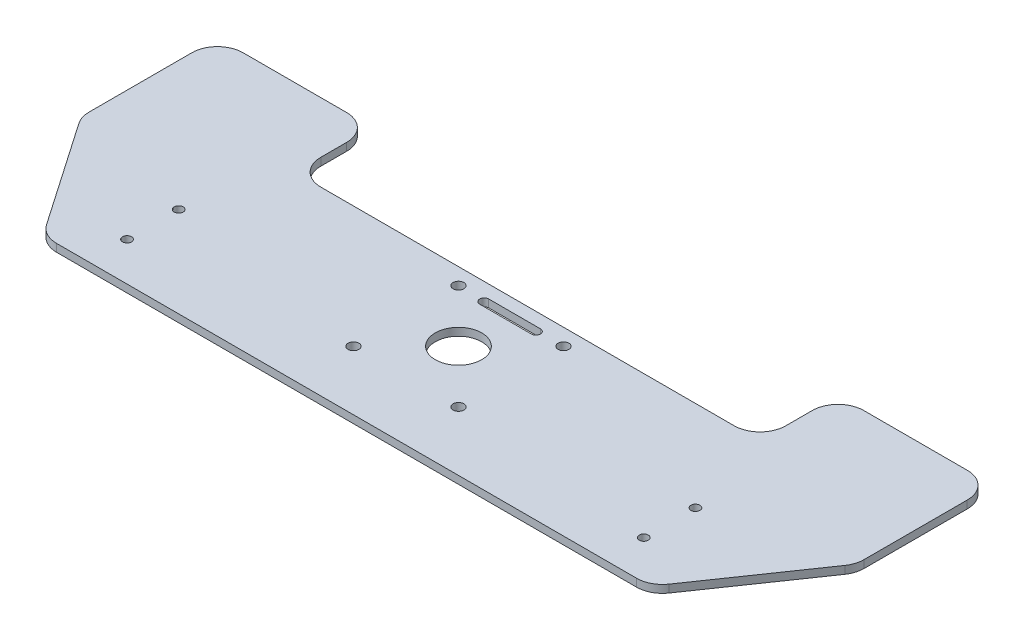
from build123d import *

# Parameters (mm, degrees)
EXTRUDE_1_DEPTH     = 3
SKETCH_2_R          = 1.75
CUT_EXTRUDE_1_DEPTH = 10
CUT_EXTRUDE_2_DEPTH = 3
SKETCH_4_R          = 9
CUT_EXTRUDE_3_DEPTH = 10
SKETCH_5_R          = 2.1
CUT_EXTRUDE_4_DEPTH = 4


with BuildPart() as part:
    # 草图1 → 凸台-拉伸1 (new body)
    with BuildSketch(Plane(origin=(0, 0, 0), x_dir=(1, 0, 0), z_dir=(0, 1, 0))):
        with BuildLine():
            Line((-148.235829522, 19.513411872), (-120.492131082, -20.771152042))
            ThreePointArc((-120.492131082, -20.771152042), (-116.908205257, -23.951300285), (-112.25630156, -25.099193643))
            Line((-112.25630156, -25.099193643), (112.25630156, -25.099193643))
            ThreePointArc((112.25630156, -25.099193643), (116.908205257, -23.951300285), (120.492131082, -20.771152042))
            Line((120.492131082, -20.771152042), (148.235829522, 19.513411872))
            ThreePointArc((148.235829522, 19.513411872), (149.548777283, 22.215378286), (150, 25.185370271))
            Line((150, 25.185370271), (150, 65))
            ThreePointArc((150, 65), (147.169490918, 72.124628896), (140.101052961, 75.092675968))
            Line((140.101052961, 75.092675968), (100.001859318, 75.092675968))
            ThreePointArc((100.001859318, 75.092675968), (92.860872953, 72.096900105), (90, 64.900806357))
            Line((90, 64.900806357), (90, 54.900806357))
            ThreePointArc((90, 54.900806357), (87.071067812, 47.829738545), (80, 44.900806357))
            Line((80, 44.900806357), (-80, 44.900806357))
            ThreePointArc((-80, 44.900806357), (-87.071067812, 47.829738545), (-90, 54.900806357))
            Line((-90, 54.900806357), (-90, 64.900806357))
            ThreePointArc((-90, 64.900806357), (-92.928932188, 71.971874169), (-100, 74.900806357))
            Line((-100, 74.900806357), (-140.099193643, 74.900806357))
            ThreePointArc((-140.099193643, 74.900806357), (-147.100120957, 72.000927314), (-150, 65))
            Line((-150, 65), (-150, 25.185370271))
            ThreePointArc((-150, 25.185370271), (-149.548777283, 22.215378286), (-148.235829522, 19.513411872))
        make_face()
    extrude(amount=EXTRUDE_1_DEPTH)

    # 草图2 → 切除-拉伸1 (cut)
    with BuildSketch(Plane(origin=(0, 3, 0), x_dir=(1, 0, 0), z_dir=(0, 1, 0))):
        with Locations(Location((100, 9.900806357, 0), (0, 0, 270))):
            Circle(SKETCH_2_R)
        with Locations(Location((100, -10.099193643, 0), (0, 0, 270))):
            Circle(SKETCH_2_R)
        with Locations(Location((-100, -10.099193643, 0), (0, 0, 90))):
            Circle(SKETCH_2_R)
        with Locations(Location((-100, 9.900806357, 0), (0, 0, 90))):
            Circle(SKETCH_2_R)
    extrude(amount=-CUT_EXTRUDE_1_DEPTH, mode=Mode.SUBTRACT)

    # 草图3 → 切除-拉伸2 (cut)
    with BuildSketch(Plane(origin=(0, 3, 0), x_dir=(1, 0, 0), z_dir=(0, 1, 0))):
        with BuildLine():
            Line((-10, 39.900806357), (10, 39.900806357))
            ThreePointArc((10, 39.900806357), (11.75, 38.150806357), (10, 36.400806357))
            Line((10, 36.400806357), (-10, 36.400806357))
            ThreePointArc((-10, 36.400806357), (-11.75, 38.150806357), (-10, 39.900806357))
        make_face()
    extrude(amount=-CUT_EXTRUDE_2_DEPTH, mode=Mode.SUBTRACT)

    # 草图4 → 切除-拉伸3 (cut)
    with BuildSketch(Plane(origin=(0, 3, 0), x_dir=(1, 0, 0), z_dir=(0, 1, 0))):
        with Locations(Location((0, 18.185077605, 0), (0, 0, 270))):
            Circle(SKETCH_4_R)
    extrude(amount=-CUT_EXTRUDE_3_DEPTH, mode=Mode.SUBTRACT)

    # 草图5 → 切除-拉伸4 (cut)
    with BuildSketch(Plane.XZ):
        with Locations(Location((-20.323459578, 2.138381974, 0), (0, 0, 270))):
            Circle(SKETCH_5_R)
        with Locations(Location((20.323459578, 2.138381974, 0), (0, 0, 270))):
            Circle(SKETCH_5_R)
        with Locations(Location((20.323459578, -38.508537183, 0), (0, 0, 270))):
            Circle(SKETCH_5_R)
        with Locations(Location((-20.323459578, -38.508537183, 0), (0, 0, 270))):
            Circle(SKETCH_5_R)
    extrude(amount=-CUT_EXTRUDE_4_DEPTH, mode=Mode.SUBTRACT)


solid = part.part
